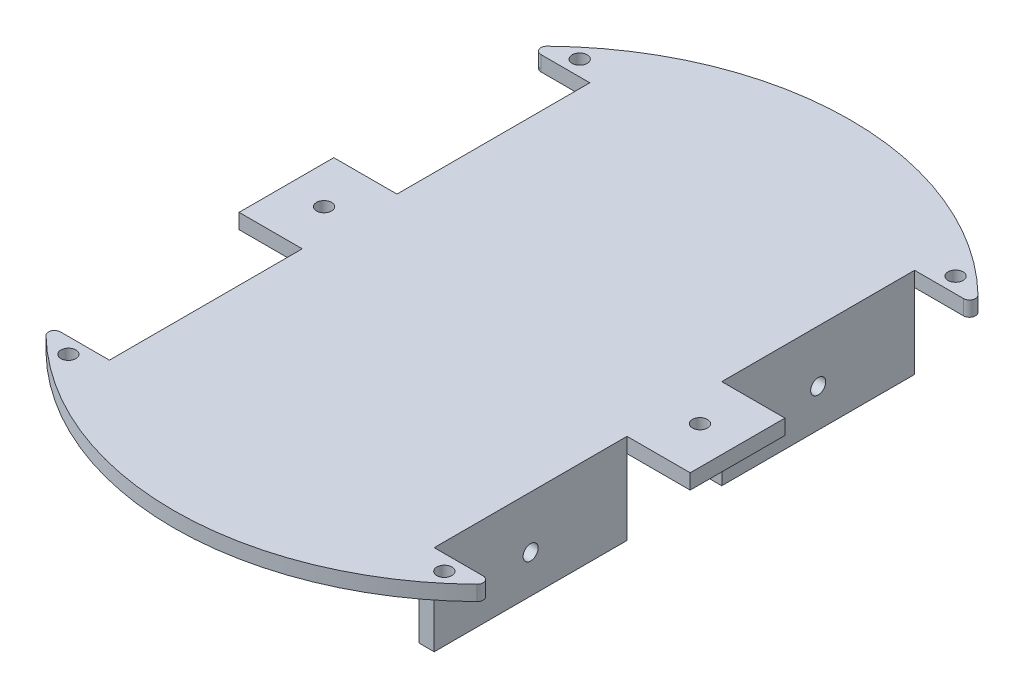
from build123d import *

# Parameters (mm, degrees)
BOSS_EXTRUDE1_DEPTH     = 5
SKETCH2_W               = 5
SKETCH2_H               = 64.125
BOSS_EXTRUDE2_DEPTH     = 25
CUT_EXTRUDE1_DEPTH      = 173.980490229
CUT_EXTRUDE1_DEPTH_BACK = 173.980490229
SKETCH3_R               = 2.5
CUT_EXTRUDE2_DEPTH      = 139.496389845
CUT_EXTRUDE2_DEPTH_BACK = 139.496389845
SKETCH4_R               = 2.5


with BuildPart() as part:
    # Sketch1 → Boss-Extrude1 (new body)
    with BuildSketch(Plane(origin=(0, 0, 0), x_dir=(1, 0, 0), z_dir=(0, 1, 0))):
        with BuildLine():
            Line((-75, 15.75), (-75, -15.75))
            Line((-75, -15.75), (-54, -15.75))
            Line((-54, -15.75), (-54, -79.875))
            Line((-54, -79.875), (-70.25200942, -79.875))
            ThreePointArc((-70.25200942, -79.875), (-72.104159031, -81.120320055), (-71.649789587, -83.305458181))
            ThreePointArc((-71.649789587, -83.305458181), (0, -112.5), (71.649789587, -83.305458181))
            ThreePointArc((71.649789587, -83.305458181), (72.104159031, -81.120320055), (70.25200942, -79.875))
            Line((70.25200942, -79.875), (54, -79.875))
            Line((54, -79.875), (54, -15.75))
            Line((54, -15.75), (75, -15.75))
            Line((75, -15.75), (75, 0))
            Line((75, 0), (75, 15.75))
            Line((75, 15.75), (54, 15.75))
            Line((54, 15.75), (54, 79.875))
            Line((54, 79.875), (70.25200942, 79.875))
            ThreePointArc((70.25200942, 79.875), (72.104159031, 81.120320055), (71.649789587, 83.305458181))
            ThreePointArc((71.649789587, 83.305458181), (0, 112.5), (-71.649789587, 83.305458181))
            ThreePointArc((-71.649789587, 83.305458181), (-72.104159031, 81.120320055), (-70.25200942, 79.875))
            Line((-70.25200942, 79.875), (-54, 79.875))
            Line((-54, 79.875), (-54, 15.75))
            Line((-54, 15.75), (-75, 15.75))
        make_face()
    extrude(amount=BOSS_EXTRUDE1_DEPTH)

    # Sketch2 → Boss-Extrude2 (add)
    with BuildSketch(Plane.XZ):
        with Locations((51.5, 47.8125)):
            Rectangle(SKETCH2_W, SKETCH2_H)
        with Locations((-51.5, 47.8125)):
            Rectangle(SKETCH2_W, SKETCH2_H)
        with Locations((-51.5, -47.8125)):
            Rectangle(SKETCH2_W, SKETCH2_H)
        with Locations((51.5, -47.8125)):
            Rectangle(SKETCH2_W, SKETCH2_H)
    extrude(amount=BOSS_EXTRUDE2_DEPTH)

    # Sketch3 → Cut-Extrude1 (cut, two sides: drawn at the far end of the back side and taken through both)
    with BuildSketch(Plane(origin=(54, 0, 0), x_dir=(0, 0, -1), z_dir=(1, 0, 0)).offset(-CUT_EXTRUDE1_DEPTH_BACK)):
        with Locations(Location((-47.8125, -12.36, 0), (0, 0, 180))):
            Circle(SKETCH3_R)
        with Locations((47.8125, -12.36)):
            Circle(SKETCH3_R)
    extrude(amount=CUT_EXTRUDE1_DEPTH + CUT_EXTRUDE1_DEPTH_BACK, mode=Mode.SUBTRACT)

    # Sketch4 → Cut-Extrude2 (cut, two sides: drawn at the far end of the back side and taken through both)
    with BuildSketch(Plane(origin=(0, 5, 0), x_dir=(1, 0, 0), z_dir=(0, 1, 0)).offset(-CUT_EXTRUDE2_DEPTH_BACK)):
        with Locations(Location((-62.5, 85, 0), (0, 0, 270))):
            Circle(SKETCH4_R)
        with Locations(Location((62.5, 85, 0), (0, 0, 270))):
            Circle(SKETCH4_R)
        with Locations(Location((62.5, 0, 0), (0, 0, 270))):
            Circle(SKETCH4_R)
        with Locations(Location((62.5, -85, 0), (0, 0, 270))):
            Circle(SKETCH4_R)
        with Locations(Location((-62.5, 0, 0), (0, 0, 270))):
            Circle(SKETCH4_R)
        with Locations(Location((-62.5, -85, 0), (0, 0, 270))):
            Circle(SKETCH4_R)
    extrude(amount=CUT_EXTRUDE2_DEPTH + CUT_EXTRUDE2_DEPTH_BACK, mode=Mode.SUBTRACT)


solid = part.part
